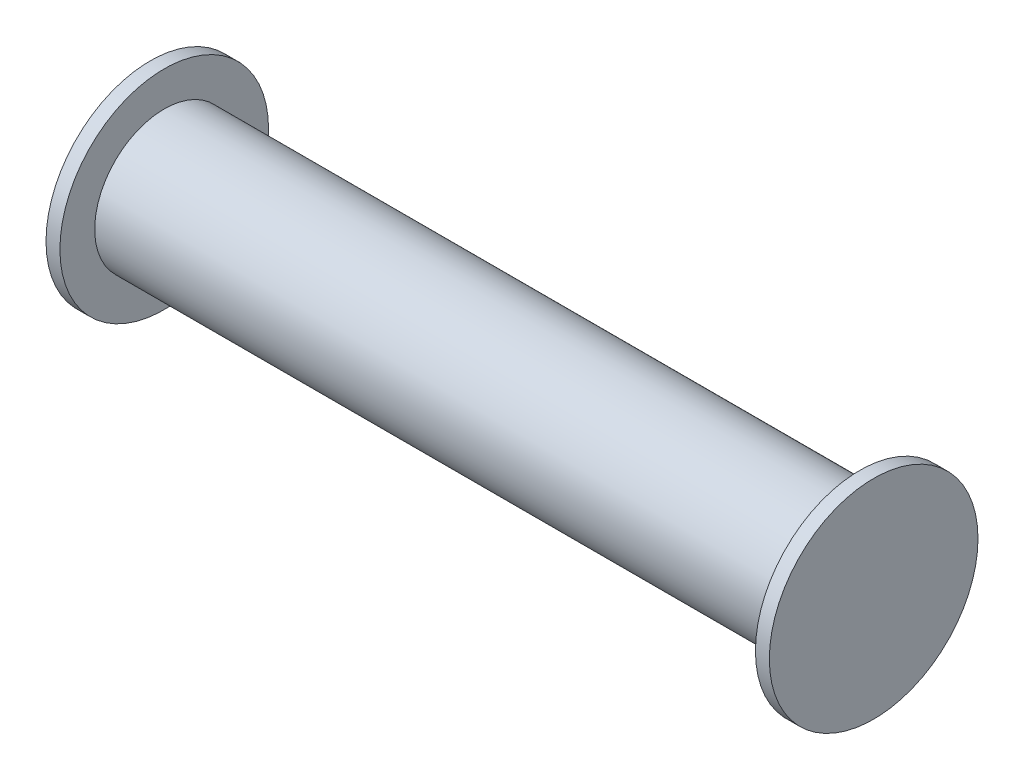
from build123d import *

# Parameters (mm, degrees)
SKETCH1_R           = 10
SKETCH1_R_2         = 8
BOSS_EXTRUDE1_DEPTH = 50
SKETCH2_R           = 15
BOSS_EXTRUDE2_DEPTH = 2
SKETCH3_R           = 15
BOSS_EXTRUDE3_DEPTH = 2


with BuildPart() as part:
    # Sketch1 → Boss-Extrude1 (new, symmetric)
    with BuildSketch(Plane(origin=(0, 0, 0), x_dir=(0, 0, -1), z_dir=(1, 0, 0))):
        Circle(SKETCH1_R)
        Circle(SKETCH1_R_2, mode=Mode.SUBTRACT)
    extrude(amount=BOSS_EXTRUDE1_DEPTH, both=True)


with BuildPart() as body_2:
    # Sketch2 → Boss-Extrude2 (new body)
    with BuildSketch(Plane(origin=(50, 0, 0), x_dir=(0, 0, -1), z_dir=(1, 0, 0))):
        Circle(SKETCH2_R)
    extrude(amount=BOSS_EXTRUDE2_DEPTH)


with BuildPart() as body_3:
    # Sketch3 → Boss-Extrude3 (new body)
    with BuildSketch(Plane.ZY.offset(50)):
        Circle(SKETCH3_R)
    extrude(amount=BOSS_EXTRUDE3_DEPTH)


solid = Compound([part.part, body_2.part, body_3.part])
